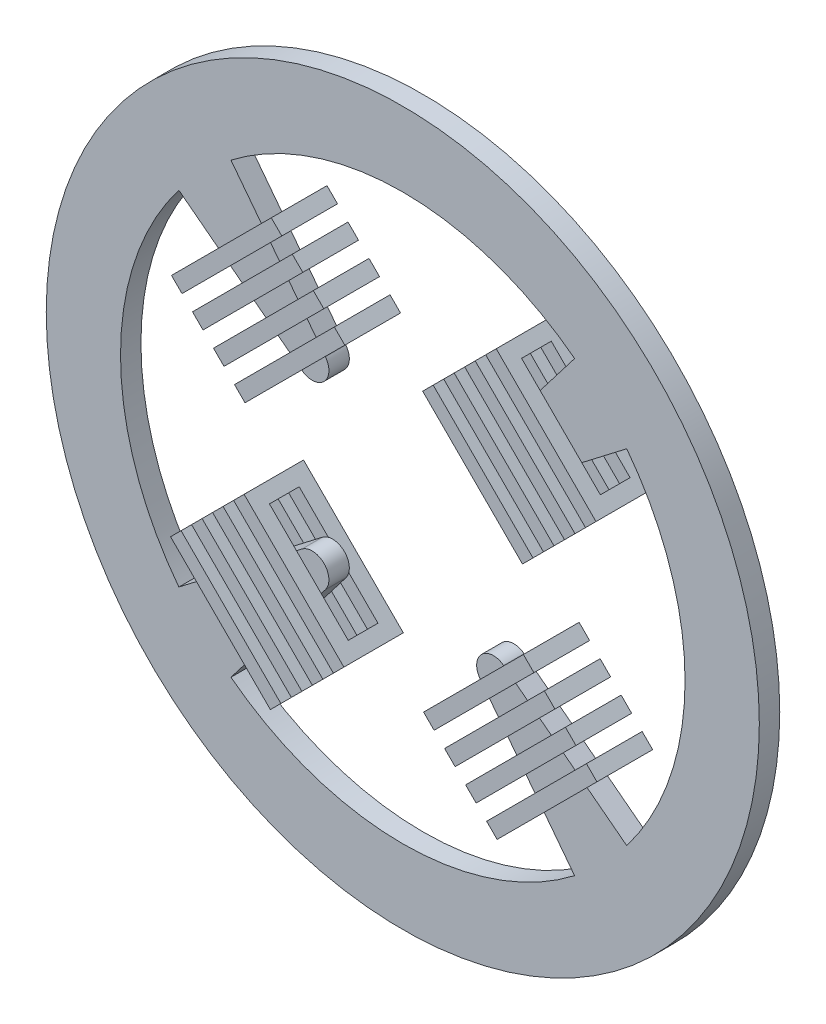
from build123d import *

# Parameters (mm, degrees)
SKETCH_1_R       = 0.96
SKETCH_1_R_2     = 0.76
EXTRUDE_1_DEPTH  = 0.055
EXTRUDE_START    = -0.055
EXTRUDE_2_DEPTH  = 0.055
SKETCH_11_W      = 0.38
SKETCH_11_H      = 0.16
SKETCH_11_W_2    = 0.3
SKETCH_11_H_2    = 0.08
EXTRUDE_3_DEPTH  = 0.04
EXTRUDE_28_DEPTH = 0.04
SKETCH_64_W      = 0.15
SKETCH_64_H      = 0.38
SKETCH_64_W_2    = 0.07
SKETCH_64_H_2    = 0.3
EXTRUDE_29_DEPTH = 0.04
SKETCH_68_W      = 0.15
SKETCH_68_H      = 0.38
SKETCH_68_W_2    = 0.07
SKETCH_68_H_2    = 0.3
EXTRUDE_30_DEPTH = 0.04
SKETCH_69_W      = 0.15
SKETCH_69_H      = 0.38
SKETCH_69_W_2    = 0.07
SKETCH_69_H_2    = 0.3
EXTRUDE_31_DEPTH = 0.04
SKETCH_70_W      = 0.15
SKETCH_70_H      = 0.38
SKETCH_70_W_2    = 0.07
SKETCH_70_H_2    = 0.3
EXTRUDE_32_DEPTH = 0.04
SKETCH_71_W      = 0.15
SKETCH_71_H      = 0.38
SKETCH_71_W_2    = 0.07
SKETCH_71_H_2    = 0.3
EXTRUDE_33_DEPTH = 0.04
SKETCH_72_W      = 0.15
SKETCH_72_H      = 0.38
SKETCH_72_W_2    = 0.07
SKETCH_72_H_2    = 0.3
EXTRUDE_34_DEPTH = 0.04
SKETCH_73_W      = 0.15
SKETCH_73_H      = 0.38
SKETCH_73_W_2    = 0.07
SKETCH_73_H_2    = 0.3
EXTRUDE_35_DEPTH = 0.04
SKETCH_76_W      = 0.38
SKETCH_76_H      = 0.16
SKETCH_76_W_2    = 0.3
SKETCH_76_H_2    = 0.08
EXTRUDE_36_DEPTH = 0.04
SKETCH_77_W      = 0.38
SKETCH_77_H      = 0.16
SKETCH_77_W_2    = 0.3
SKETCH_77_H_2    = 0.08
EXTRUDE_37_DEPTH = 0.04
SKETCH_78_W      = 0.38
SKETCH_78_H      = 0.16
SKETCH_78_W_2    = 0.3
SKETCH_78_H_2    = 0.08
EXTRUDE_38_DEPTH = 0.04
SKETCH_79_W      = 0.38
SKETCH_79_H      = 0.16
SKETCH_79_W_2    = 0.3
SKETCH_79_H_2    = 0.08
EXTRUDE_39_DEPTH = 0.04
SKETCH_80_W      = 0.38
SKETCH_80_H      = 0.16
SKETCH_80_W_2    = 0.3
SKETCH_80_H_2    = 0.08
EXTRUDE_40_DEPTH = 0.04
SKETCH_81_W      = 0.38
SKETCH_81_H      = 0.16
SKETCH_81_W_2    = 0.3
SKETCH_81_H_2    = 0.08
EXTRUDE_41_DEPTH = 0.04
SKETCH_82_W      = 0.38
SKETCH_82_H      = 0.16
SKETCH_82_W_2    = 0.3
SKETCH_82_H_2    = 0.08
EXTRUDE_42_DEPTH = 0.04


with BuildPart() as part:
    # 草圖1 → 填料-伸長1 (new body)
    with BuildSketch(Plane.XY):
        Circle(SKETCH_1_R)
        Circle(SKETCH_1_R_2, mode=Mode.SUBTRACT)
    extrude(amount=EXTRUDE_1_DEPTH)

    # 草圖2 → 填料-伸長2 (add)
    with BuildSketch(Plane.XY.offset(0.055).offset(EXTRUDE_START)):
        with BuildLine():
            Line((-0.208247811, 0.271393831), (-0.462658686, 0.602948539))
            ThreePointArc((-0.462658686, 0.602948539), (-0.537401154, 0.537401154), (-0.602948539, 0.462658686))
            Line((-0.602948539, 0.462658686), (-0.271393831, 0.208247811))
            ThreePointArc((-0.271393831, 0.208247811), (-0.241031974, 0.199037642), (-0.212132034, 0.212132034))
            ThreePointArc((-0.212132034, 0.212132034), (-0.199037642, 0.241031974), (-0.208247811, 0.271393831))
        make_face()
        with BuildLine():
            ThreePointArc((0.208247811, 0.271393831), (0.199037642, 0.241031974), (0.212132034, 0.212132034))
            ThreePointArc((0.212132034, 0.212132034), (0.241031974, 0.199037642), (0.271393831, 0.208247811))
            Line((0.271393831, 0.208247811), (0.602948539, 0.462658686))
            ThreePointArc((0.602948539, 0.462658686), (0.537401154, 0.537401154), (0.462658686, 0.602948539))
            Line((0.462658686, 0.602948539), (0.208247811, 0.271393831))
        make_face()
        with BuildLine():
            ThreePointArc((0.271393831, -0.208247811), (0.241031974, -0.199037642), (0.212132034, -0.212132034))
            ThreePointArc((0.212132034, -0.212132034), (0.199037642, -0.241031974), (0.208247811, -0.271393831))
            Line((0.208247811, -0.271393831), (0.462658686, -0.602948539))
            ThreePointArc((0.462658686, -0.602948539), (0.537401154, -0.537401154), (0.602948539, -0.462658686))
            Line((0.602948539, -0.462658686), (0.271393831, -0.208247811))
        make_face()
        with BuildLine():
            ThreePointArc((-0.208247811, -0.271393831), (-0.199037642, -0.241031974), (-0.212132034, -0.212132034))
            ThreePointArc((-0.212132034, -0.212132034), (-0.241031974, -0.199037642), (-0.271393831, -0.208247811))
            Line((-0.271393831, -0.208247811), (-0.602948539, -0.462658686))
            ThreePointArc((-0.602948539, -0.462658686), (-0.537401154, -0.537401154), (-0.462658686, -0.602948539))
            Line((-0.462658686, -0.602948539), (-0.208247811, -0.271393831))
        make_face()
    extrude(amount=EXTRUDE_2_DEPTH)


with BuildPart() as body_2:
    # 草圖11 → 填料-伸長3 (new body)
    with BuildSketch(Plane(origin=(0.240416306, 0.240416306, 0), x_dir=(-0.7071067811865476, 0.7071067811865476, 0), z_dir=(0.7071067811865476, 0.7071067811865476, 0))):
        with Locations((0, 0.0275)):
            Rectangle(SKETCH_11_W, SKETCH_11_H)
        with Locations((0, 0.0275)):
            Rectangle(SKETCH_11_W_2, SKETCH_11_H_2, mode=Mode.SUBTRACT)
    extrude(amount=EXTRUDE_3_DEPTH)


with BuildPart() as body_3:
    # 草圖62 → 填料-伸長28 (new body)
    with BuildSketch(Plane(origin=(0.240416306, -0.240416306, 0), x_dir=(0.7071067811865477, 0.7071067811865475, 0), z_dir=(0.7071067811865475, -0.7071067811865477, 0))):
        Polygon((0, -0.005), (0, -0.045), (0.19, -0.045), (0.19, 0.105), (0, 0.105), (0, 0.065), (0.15, 0.065), (0.15, -0.005), align=None)
        Polygon((-0.19, -0.045), (0, -0.045), (0, -0.005), (-0.15, -0.005), (-0.15, 0.065), (0, 0.065), (0, 0.105), (-0.19, 0.105), align=None)
    extrude(amount=EXTRUDE_28_DEPTH)


with BuildPart() as body_4:
    # 草圖64 → 填料-伸長29 (new body)
    with BuildSketch(Plane(origin=(0.296984848, -0.296984848, 0), x_dir=(0, 0, -1), z_dir=(0.7071067811865487, -0.7071067811865464, 0))):
        with Locations((-0.03, 0)):
            Rectangle(SKETCH_64_W, SKETCH_64_H)
        with Locations((-0.03, 0)):
            Rectangle(SKETCH_64_W_2, SKETCH_64_H_2, mode=Mode.SUBTRACT)
    extrude(amount=EXTRUDE_29_DEPTH)


with BuildPart() as body_5:
    # 草圖68 → 填料-伸長30 (new body)
    with BuildSketch(Plane(origin=(0.353553391, -0.353553391, 0), x_dir=(0, 0, -1), z_dir=(0.7071067811865487, -0.7071067811865464, 0))):
        with Locations((-0.03, 0)):
            Rectangle(SKETCH_68_W, SKETCH_68_H)
        with Locations((-0.03, 0)):
            Rectangle(SKETCH_68_W_2, SKETCH_68_H_2, mode=Mode.SUBTRACT)
    extrude(amount=EXTRUDE_30_DEPTH)


with BuildPart() as body_6:
    # 草圖69 → 填料-伸長31 (new body)
    with BuildSketch(Plane(origin=(0.410121933, -0.410121933, 0), x_dir=(0, 0, -1), z_dir=(0.7071067811865487, -0.7071067811865464, 0))):
        with Locations((-0.03, 0)):
            Rectangle(SKETCH_69_W, SKETCH_69_H)
        with Locations((-0.03, 0)):
            Rectangle(SKETCH_69_W_2, SKETCH_69_H_2, mode=Mode.SUBTRACT)
    extrude(amount=EXTRUDE_31_DEPTH)


with BuildPart() as body_7:
    # 草圖70 → 填料-伸長32 (new body)
    with BuildSketch(Plane(origin=(-0.240416306, 0.240416306, 0), x_dir=(0, 0, -1), z_dir=(0.7071067811865487, -0.7071067811865464, 0))):
        with Locations((-0.03, 0)):
            Rectangle(SKETCH_70_W, SKETCH_70_H)
        with Locations((-0.03, 0)):
            Rectangle(SKETCH_70_W_2, SKETCH_70_H_2, mode=Mode.SUBTRACT)
    extrude(amount=-EXTRUDE_32_DEPTH)


with BuildPart() as body_8:
    # 草圖71 → 填料-伸長33 (new body)
    with BuildSketch(Plane(origin=(-0.296984848, 0.296984848, 0), x_dir=(0, 0, -1), z_dir=(0.7071067811865487, -0.7071067811865464, 0))):
        with Locations((-0.03, 0)):
            Rectangle(SKETCH_71_W, SKETCH_71_H)
        with Locations((-0.03, 0)):
            Rectangle(SKETCH_71_W_2, SKETCH_71_H_2, mode=Mode.SUBTRACT)
    extrude(amount=-EXTRUDE_33_DEPTH)


with BuildPart() as body_9:
    # 草圖72 → 填料-伸長34 (new body)
    with BuildSketch(Plane(origin=(-0.353553391, 0.353553391, 0), x_dir=(0, 0, -1), z_dir=(0.7071067811865487, -0.7071067811865464, 0))):
        with Locations((-0.03, 0)):
            Rectangle(SKETCH_72_W, SKETCH_72_H)
        with Locations((-0.03, 0)):
            Rectangle(SKETCH_72_W_2, SKETCH_72_H_2, mode=Mode.SUBTRACT)
    extrude(amount=-EXTRUDE_34_DEPTH)


with BuildPart() as body_10:
    # 草圖73 → 填料-伸長35 (new body)
    with BuildSketch(Plane(origin=(-0.410121933, 0.410121933, 0), x_dir=(0, 0, -1), z_dir=(0.7071067811865487, -0.7071067811865464, 0))):
        with Locations((-0.03, 0)):
            Rectangle(SKETCH_73_W, SKETCH_73_H)
        with Locations((-0.03, 0)):
            Rectangle(SKETCH_73_W_2, SKETCH_73_H_2, mode=Mode.SUBTRACT)
    extrude(amount=-EXTRUDE_35_DEPTH)


with BuildPart() as body_11:
    # 草圖76 → 填料-伸長36 (new body)
    with BuildSketch(Plane(origin=(0.296984848, 0.296984848, 0), x_dir=(0.7071067811865515, -0.7071067811865436, 0), z_dir=(0.7071067811865436, 0.7071067811865515, 0))):
        with Locations((0, -0.0275)):
            Rectangle(SKETCH_76_W, SKETCH_76_H)
        with Locations((0, -0.0275)):
            Rectangle(SKETCH_76_W_2, SKETCH_76_H_2, mode=Mode.SUBTRACT)
    extrude(amount=EXTRUDE_36_DEPTH)


with BuildPart() as body_12:
    # 草圖77 → 填料-伸長37 (new body)
    with BuildSketch(Plane(origin=(0.353553391, 0.353553391, 0), x_dir=(0.7071067811865515, -0.7071067811865436, 0), z_dir=(0.7071067811865436, 0.7071067811865515, 0))):
        with Locations((0, -0.0275)):
            Rectangle(SKETCH_77_W, SKETCH_77_H)
        with Locations((0, -0.0275)):
            Rectangle(SKETCH_77_W_2, SKETCH_77_H_2, mode=Mode.SUBTRACT)
    extrude(amount=EXTRUDE_37_DEPTH)


with BuildPart() as body_13:
    # 草圖78 → 填料-伸長38 (new body)
    with BuildSketch(Plane(origin=(0.410121933, 0.410121933, 0), x_dir=(0.7071067811865515, -0.7071067811865436, 0), z_dir=(0.7071067811865436, 0.7071067811865515, 0))):
        with Locations((0, -0.0275)):
            Rectangle(SKETCH_78_W, SKETCH_78_H)
        with Locations((0, -0.0275)):
            Rectangle(SKETCH_78_W_2, SKETCH_78_H_2, mode=Mode.SUBTRACT)
    extrude(amount=EXTRUDE_38_DEPTH)


with BuildPart() as body_14:
    # 草圖79 → 填料-伸長39 (new body)
    with BuildSketch(Plane(origin=(-0.240416306, -0.240416306, 0), x_dir=(0.7071067811865515, -0.7071067811865436, 0), z_dir=(0.7071067811865436, 0.7071067811865515, 0))):
        with Locations((0, -0.0275)):
            Rectangle(SKETCH_79_W, SKETCH_79_H)
        with Locations((0, -0.0275)):
            Rectangle(SKETCH_79_W_2, SKETCH_79_H_2, mode=Mode.SUBTRACT)
    extrude(amount=-EXTRUDE_39_DEPTH)


with BuildPart() as body_15:
    # 草圖80 → 填料-伸長40 (new body)
    with BuildSketch(Plane(origin=(-0.296984848, -0.296984848, 0), x_dir=(0.7071067811865515, -0.7071067811865436, 0), z_dir=(0.7071067811865436, 0.7071067811865515, 0))):
        with Locations((0, -0.0275)):
            Rectangle(SKETCH_80_W, SKETCH_80_H)
        with Locations((0, -0.0275)):
            Rectangle(SKETCH_80_W_2, SKETCH_80_H_2, mode=Mode.SUBTRACT)
    extrude(amount=-EXTRUDE_40_DEPTH)


with BuildPart() as body_16:
    # 草圖81 → 填料-伸長41 (new body)
    with BuildSketch(Plane(origin=(-0.353553391, -0.353553391, 0), x_dir=(0.7071067811865515, -0.7071067811865436, 0), z_dir=(0.7071067811865436, 0.7071067811865515, 0))):
        with Locations((0, -0.0275)):
            Rectangle(SKETCH_81_W, SKETCH_81_H)
        with Locations((0, -0.0275)):
            Rectangle(SKETCH_81_W_2, SKETCH_81_H_2, mode=Mode.SUBTRACT)
    extrude(amount=-EXTRUDE_41_DEPTH)


with BuildPart() as body_17:
    # 草圖82 → 填料-伸長42 (new body)
    with BuildSketch(Plane(origin=(-0.410121933, -0.410121933, 0), x_dir=(0.7071067811865515, -0.7071067811865436, 0), z_dir=(0.7071067811865436, 0.7071067811865515, 0))):
        with Locations((0, -0.0275)):
            Rectangle(SKETCH_82_W, SKETCH_82_H)
        with Locations((0, -0.0275)):
            Rectangle(SKETCH_82_W_2, SKETCH_82_H_2, mode=Mode.SUBTRACT)
    extrude(amount=-EXTRUDE_42_DEPTH)


solid = Compound([part.part, body_2.part, body_3.part, body_4.part, body_5.part, body_6.part, body_7.part, body_8.part, body_9.part, body_10.part, body_11.part, body_12.part, body_13.part, body_14.part, body_15.part, body_16.part, body_17.part])
